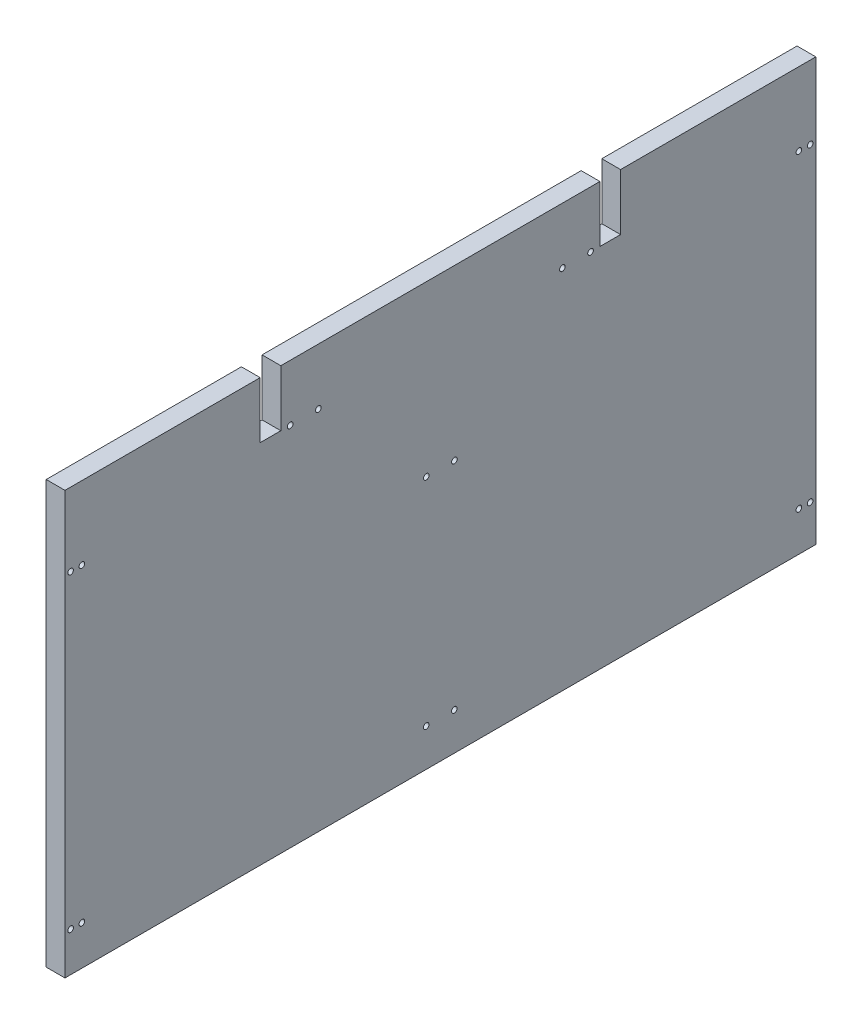
from build123d import *

# Parameters (mm, degrees)
EXTRUDE_1_DEPTH     = 10
SKETCH_2_R          = 1.5
CUT_EXTRUDE_1_DEPTH = 6
SKETCH_3_R          = 1.5
CUT_EXTRUDE_2_DEPTH = 5
SKETCH_4_R          = 1.5
CUT_EXTRUDE_3_DEPTH = 10
SKETCH_5_R          = 1.5
CUT_EXTRUDE_4_DEPTH = 10
SKETCH_6_R          = 1.5
CUT_EXTRUDE_5_DEPTH = 10


with BuildPart() as part:
    # 草图1 → 凸台-拉伸1 (new body)
    with BuildSketch(Plane(origin=(0, 0, 0), x_dir=(0, 0, -1), z_dir=(1, 0, 0))):
        Polygon((96, 112.5), (200, 112.5), (200, -112.5), (-200, -112.5), (-200, 112.5), (-96, 112.5), (-96, 82.5), (-85, 82.5), (-85, 112.5), (85, 112.5), (85, 82.5), (96, 82.5), align=None)
    extrude(amount=EXTRUDE_1_DEPTH)

    # 草图2 → 切除-拉伸1 (cut)
    with BuildSketch(Plane.ZY):
        with Locations((-84, -105.5)):
            Circle(SKETCH_2_R)
        with Locations((-66, -105.5)):
            Circle(SKETCH_2_R)
        with Locations((-9, -105.5)):
            Circle(SKETCH_2_R)
        with Locations((9, -105.5)):
            Circle(SKETCH_2_R)
        with Locations((66, -105.5)):
            Circle(SKETCH_2_R)
        with Locations((84, -105.5)):
            Circle(SKETCH_2_R)
    extrude(amount=-CUT_EXTRUDE_1_DEPTH, mode=Mode.SUBTRACT)

    # 草图3 → 切除-拉伸2 (cut)
    with BuildSketch(Plane(origin=(10, 0, 0), x_dir=(0, 0, -1), z_dir=(1, 0, 0))):
        with Locations((197, -91.5)):
            Circle(SKETCH_3_R)
        with Locations((191, -91.5)):
            Circle(SKETCH_3_R)
        with Locations((191, 73.5)):
            Circle(SKETCH_3_R)
        with Locations((197, 73.5)):
            Circle(SKETCH_3_R)
    cut_extrude_2 = extrude(amount=-CUT_EXTRUDE_2_DEPTH, mode=Mode.SUBTRACT)

    # 镜向1: 切除-拉伸2 across plane
    add(cut_extrude_2.mirror(Plane.XY), mode=Mode.SUBTRACT)

    # 草图4 → 切除-拉伸3 (cut)
    with BuildSketch(Plane(origin=(10, 0, 0), x_dir=(0, 0, -1), z_dir=(1, 0, 0))):
        with Locations((7.43, -92.5)):
            Circle(SKETCH_4_R)
        with Locations((-7.57, -92.5)):
            Circle(SKETCH_4_R)
    extrude(amount=-CUT_EXTRUDE_3_DEPTH, mode=Mode.SUBTRACT)

    # 草图5 → 切除-拉伸4 (cut)
    with BuildSketch(Plane(origin=(10, 0, 0), x_dir=(0, 0, -1), z_dir=(1, 0, 0))):
        with Locations((-80, 82.5)):
            Circle(SKETCH_5_R)
        with Locations((-65, 82.5)):
            Circle(SKETCH_5_R)
    cut_extrude_4 = extrude(amount=-CUT_EXTRUDE_4_DEPTH, mode=Mode.SUBTRACT)

    # 镜向2: 切除-拉伸4 across plane
    add(cut_extrude_4.mirror(Plane.XY), mode=Mode.SUBTRACT)

    # 草图6 → 切除-拉伸5 (cut)
    with BuildSketch(Plane(origin=(10, 0, 0), x_dir=(0, 0, -1), z_dir=(1, 0, 0))):
        with Locations((-7.5, 22.5)):
            Circle(SKETCH_6_R)
        with Locations((7.5, 22.5)):
            Circle(SKETCH_6_R)
    extrude(amount=-CUT_EXTRUDE_5_DEPTH, mode=Mode.SUBTRACT)


solid = part.part
